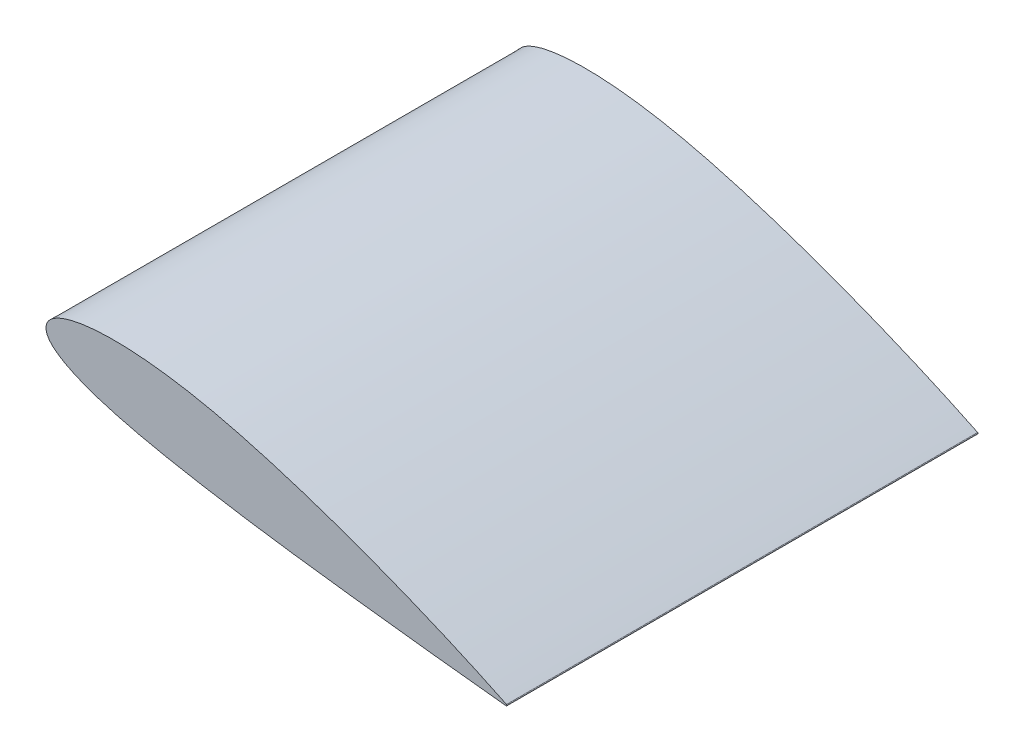
from build123d import *

# Parameters (mm, degrees)
BOSS_EXTRUDE1_DEPTH = 127


with BuildPart() as part:
    # Sketch1 → Boss-Extrude1 (new body)
    with BuildSketch(Plane.XY):
        with BuildLine():
            ThreePointArc((93.05866034, -19.576632663), (93.16855897, -19.80358855), (92.9758503, -19.96622327))
            add(Edge.make_bspline(
                [(93.05866034, -19.576632663), (92.957002403, -19.526335478), (92.539517715, -19.31977704), (91.591913609, -18.871381829), (90.020940239, -18.120758983), (87.838214719, -17.098828255), (85.066521259, -15.821317225), (81.732262686, -14.313275302), (77.864443498, -12.610049724), (73.503574448, -10.736597346), (68.690490219, -8.73236563), (63.474966761, -6.629469679), (57.908616951, -4.467050907), (52.049648773, -2.280327522), (45.958672309, -0.108341606), (39.699523955, 2.010038397), (33.338487352, 4.039939768), (26.939788818, 5.938531094), (20.556097815, 7.68719028), (14.245161383, 9.211620806), (8.078676903, 10.472103329), (2.147932934, 11.446184853), (-3.474533628, 12.127374154), (-8.722105332, 12.50959383), (-13.530455216, 12.605959548), (-17.842271406, 12.424617782), (-21.60782663, 11.994136734), (-24.785230361, 11.330750601), (-27.349384412, 10.464386921), (-29.286745932, 9.407682777), (-30.603657033, 8.137443081), (-31.185850318, 6.615355323), (-30.948197504, 5.006720799), (-29.959069261, 3.479985684), (-28.33683184, 2.016502726), (-26.093534433, 0.578915897), (-23.244236964, -0.830892785), (-19.814665374, -2.205008099), (-15.839541748, -3.531027536), (-11.361747266, -4.804609983), (-6.428842312, -6.021231317), (-1.092697288, -7.18321858), (4.590080403, -8.29433151), (10.559112078, -9.363054541), (16.769334976, -10.407718585), (23.157294914, -11.422047871), (29.659289179, -12.372954722), (36.180763289, -13.272940149), (42.64804247, -14.122508454), (48.987978383, -14.92420166), (55.128796639, -15.682444714), (61.002780085, -16.38682544), (66.542926391, -17.040525918), (71.687451514, -17.635091678), (76.377396065, -18.168051006), (80.558605362, -18.636564901), (84.18377901, -19.033558561), (87.210319631, -19.35912009), (89.602886861, -19.612864982), (91.332079736, -19.79552172), (92.382692063, -19.903120905), (92.854106848, -19.953271752), (92.9758503, -19.96622327)],
                knots=[0, 0, 0, 0, 0.001303345, 0.005352522, 0.012046339, 0.021311094, 0.033047622, 0.047117215, 0.063362508, 0.081612115, 0.101657457, 0.123273921, 0.14623252, 0.170277757, 0.195135791, 0.22054026, 0.24620839, 0.271859818, 0.29723365, 0.322260275, 0.346452958, 0.369543631, 0.391307276, 0.411513241, 0.429980367, 0.446542667, 0.461070389, 0.473485742, 0.483779539, 0.492063936, 0.498681588, 0.504376593, 0.510069863, 0.516664638, 0.524877655, 0.535024569, 0.547190471, 0.561360064, 0.577448521, 0.59532385, 0.614843137, 0.635823686, 0.658074561, 0.68137887, 0.705504986, 0.730440424, 0.755703478, 0.781015275, 0.806090941, 0.83065955, 0.854449961, 0.877193251, 0.898643274, 0.918555547, 0.936704445, 0.952884106, 0.96690411, 0.978611738, 0.98786388, 0.994552223, 0.998593105, 1, 1, 1, 1], degree=3))
        make_face()
    extrude(amount=-BOSS_EXTRUDE1_DEPTH)


solid = part.part
